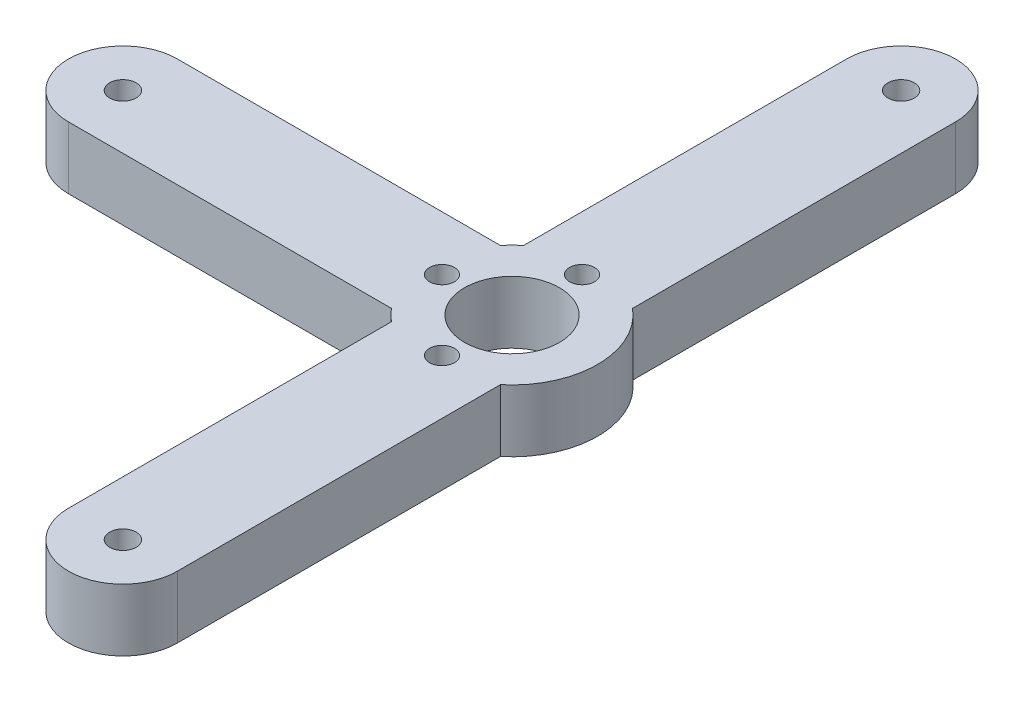
from build123d import *

# Parameters (mm, degrees)
BASE_OUTLINE_SKETCH_R          = 6.1
BASE_OUTLINE_SKETCH_R_2        = 3.1
BASE_OUTLINE_DEPTH             = 1
INTERFACE_PROFILE_2_SKETCH_R   = 6.1
INTERFACE_PROFILE_2_SKETCH_R_2 = 3.1
INTERFACE_PROFILE_2_SKETCH_R_3 = 1.1
INTERFACE_PROFILE_2_DEPTH      = 0.6
INTERFACE_PROFILE_3_SKETCH_R   = 1.7
INTERFACE_PROFILE_3_SKETCH_R_2 = 6.1
INTERFACE_PROFILE_3_SKETCH_R_3 = 1.1
INTERFACE_PROFILE_3_DEPTH      = 2.4
INTERFACE_PROFILE_4_SKETCH_R   = 1.7
INTERFACE_PROFILE_4_SKETCH_R_2 = 6.1
INTERFACE_PROFILE_4_SKETCH_R_3 = 1.6
INTERFACE_PROFILE_4_DEPTH      = 4


with BuildPart() as part:
    # Base Outline Sketch → Base Outline (new body)
    with BuildSketch(Plane(origin=(0, 149, 0), x_dir=(1, 0, 0), z_dir=(0, 1, 0))):
        with BuildLine():
            Line((-64.77693262, -7), (-106.291651246, -7))
            ThreePointArc((-106.291651246, -7), (-113.291651246, 0), (-106.291651246, 7))
            Line((-106.291651246, 7), (-64.77693262, 7))
            ThreePointArc((-64.77693262, 7), (-64.069825839, 7.778174593), (-63.291651246, 8.485281374))
            Line((-63.291651246, 8.485281374), (-63.291651246, 50))
            ThreePointArc((-63.291651246, 50), (-56.291651246, 57), (-49.291651246, 50))
            Line((-49.291651246, 50), (-49.291651246, 8.485281374))
            ThreePointArc((-49.291651246, 8.485281374), (-45.291651246, 0), (-49.291651246, -8.485281374))
            Line((-49.291651246, -8.485281374), (-49.291651246, -50))
            ThreePointArc((-49.291651246, -50), (-56.291651246, -57), (-63.291651246, -50))
            Line((-63.291651246, -50), (-63.291651246, -8.485281374))
            ThreePointArc((-63.291651246, -8.485281374), (-64.069825839, -7.778174593), (-64.77693262, -7))
        make_face()
        with Locations(Location((-56.291651246, 0, 0), (0, 0, 270))):
            Circle(BASE_OUTLINE_SKETCH_R, mode=Mode.SUBTRACT)
        with Locations(Location((-106.291651246, 0, 0), (0, 0, 270))):
            Circle(BASE_OUTLINE_SKETCH_R_2, mode=Mode.SUBTRACT)
        with Locations(Location((-56.291651246, 50, 0), (0, 0, 270))):
            Circle(BASE_OUTLINE_SKETCH_R_2, mode=Mode.SUBTRACT)
        with Locations(Location((-56.291651246, -50, 0), (0, 0, 270))):
            Circle(BASE_OUTLINE_SKETCH_R_2, mode=Mode.SUBTRACT)
    extrude(amount=BASE_OUTLINE_DEPTH)

    # Interface Profile 2 Sketch → Interface Profile 2 (add)
    with BuildSketch(Plane(origin=(0, 150, 0), x_dir=(1, 0, 0), z_dir=(0, 1, 0))):
        with BuildLine():
            Line((-64.77693262, -7), (-106.291651246, -7))
            ThreePointArc((-106.291651246, -7), (-113.291651246, 0), (-106.291651246, 7))
            Line((-106.291651246, 7), (-64.77693262, 7))
            ThreePointArc((-64.77693262, 7), (-64.069825839, 7.778174593), (-63.291651246, 8.485281374))
            Line((-63.291651246, 8.485281374), (-63.291651246, 50))
            ThreePointArc((-63.291651246, 50), (-56.291651246, 57), (-49.291651246, 50))
            Line((-49.291651246, 50), (-49.291651246, 8.485281374))
            ThreePointArc((-49.291651246, 8.485281374), (-45.291651246, 0), (-49.291651246, -8.485281374))
            Line((-49.291651246, -8.485281374), (-49.291651246, -50))
            ThreePointArc((-49.291651246, -50), (-56.291651246, -57), (-63.291651246, -50))
            Line((-63.291651246, -50), (-63.291651246, -8.485281374))
            ThreePointArc((-63.291651246, -8.485281374), (-64.069825839, -7.778174593), (-64.77693262, -7))
        make_face()
        with Locations(Location((-56.291651246, 0, 0), (0, 0, 270))):
            Circle(INTERFACE_PROFILE_2_SKETCH_R, mode=Mode.SUBTRACT)
        with Locations(Location((-106.291651246, 0, 0), (0, 0, 270))):
            Circle(INTERFACE_PROFILE_2_SKETCH_R_2, mode=Mode.SUBTRACT)
        with Locations(Location((-56.291651246, 50, 0), (0, 0, 270))):
            Circle(INTERFACE_PROFILE_2_SKETCH_R_2, mode=Mode.SUBTRACT)
        with Locations(Location((-56.291651246, -50, 0), (0, 0, 270))):
            Circle(INTERFACE_PROFILE_2_SKETCH_R_2, mode=Mode.SUBTRACT)
        with Locations(Location((-65.291651246, 0, 0), (0, 0, 270))):
            Circle(INTERFACE_PROFILE_2_SKETCH_R_3, mode=Mode.SUBTRACT)
        with Locations(Location((-56.291651246, -9, 0), (0, 0, 270))):
            Circle(INTERFACE_PROFILE_2_SKETCH_R_3, mode=Mode.SUBTRACT)
        with Locations(Location((-56.291651246, 9, 0), (0, 0, 270))):
            Circle(INTERFACE_PROFILE_2_SKETCH_R_3, mode=Mode.SUBTRACT)
    extrude(amount=INTERFACE_PROFILE_2_DEPTH)

    # Interface Profile 3 Sketch → Interface Profile 3 (add)
    with BuildSketch(Plane(origin=(0, 150.6, 0), x_dir=(1, 0, 0), z_dir=(0, 1, 0))):
        with BuildLine():
            Line((-64.77693262, -7), (-106.291651246, -7))
            ThreePointArc((-106.291651246, -7), (-113.291651246, 0), (-106.291651246, 7))
            Line((-106.291651246, 7), (-64.77693262, 7))
            ThreePointArc((-64.77693262, 7), (-64.069825839, 7.778174593), (-63.291651246, 8.485281374))
            Line((-63.291651246, 8.485281374), (-63.291651246, 50))
            ThreePointArc((-63.291651246, 50), (-56.291651246, 57), (-49.291651246, 50))
            Line((-49.291651246, 50), (-49.291651246, 8.485281374))
            ThreePointArc((-49.291651246, 8.485281374), (-45.291651246, 0), (-49.291651246, -8.485281374))
            Line((-49.291651246, -8.485281374), (-49.291651246, -50))
            ThreePointArc((-49.291651246, -50), (-56.291651246, -57), (-63.291651246, -50))
            Line((-63.291651246, -50), (-63.291651246, -8.485281374))
            ThreePointArc((-63.291651246, -8.485281374), (-64.069825839, -7.778174593), (-64.77693262, -7))
        make_face()
        with Locations(Location((-106.291651246, 0, 0), (0, 0, 270))):
            Circle(INTERFACE_PROFILE_3_SKETCH_R, mode=Mode.SUBTRACT)
        with Locations(Location((-56.291651246, 50, 0), (0, 0, 270))):
            Circle(INTERFACE_PROFILE_3_SKETCH_R, mode=Mode.SUBTRACT)
        with Locations(Location((-56.291651246, 0, 0), (0, 0, 270))):
            Circle(INTERFACE_PROFILE_3_SKETCH_R_2, mode=Mode.SUBTRACT)
        with Locations(Location((-56.291651246, -50, 0), (0, 0, 270))):
            Circle(INTERFACE_PROFILE_3_SKETCH_R, mode=Mode.SUBTRACT)
        with Locations(Location((-65.291651246, 0, 0), (0, 0, 270))):
            Circle(INTERFACE_PROFILE_3_SKETCH_R_3, mode=Mode.SUBTRACT)
        with Locations(Location((-56.291651246, -9, 0), (0, 0, 270))):
            Circle(INTERFACE_PROFILE_3_SKETCH_R_3, mode=Mode.SUBTRACT)
        with Locations(Location((-56.291651246, 9, 0), (0, 0, 270))):
            Circle(INTERFACE_PROFILE_3_SKETCH_R_3, mode=Mode.SUBTRACT)
    extrude(amount=INTERFACE_PROFILE_3_DEPTH)

    # Interface Profile 4 Sketch → Interface Profile 4 (add)
    with BuildSketch(Plane(origin=(0, 153, 0), x_dir=(1, 0, 0), z_dir=(0, 1, 0))):
        with BuildLine():
            Line((-64.77693262, -7), (-106.291651246, -7))
            ThreePointArc((-106.291651246, -7), (-113.291651246, 0), (-106.291651246, 7))
            Line((-106.291651246, 7), (-64.77693262, 7))
            ThreePointArc((-64.77693262, 7), (-64.069825839, 7.778174593), (-63.291651246, 8.485281374))
            Line((-63.291651246, 8.485281374), (-63.291651246, 50))
            ThreePointArc((-63.291651246, 50), (-56.291651246, 57), (-49.291651246, 50))
            Line((-49.291651246, 50), (-49.291651246, 8.485281374))
            ThreePointArc((-49.291651246, 8.485281374), (-45.291651246, 0), (-49.291651246, -8.485281374))
            Line((-49.291651246, -8.485281374), (-49.291651246, -50))
            ThreePointArc((-49.291651246, -50), (-56.291651246, -57), (-63.291651246, -50))
            Line((-63.291651246, -50), (-63.291651246, -8.485281374))
            ThreePointArc((-63.291651246, -8.485281374), (-64.069825839, -7.778174593), (-64.77693262, -7))
        make_face()
        with Locations(Location((-106.291651246, 0, 0), (0, 0, 270))):
            Circle(INTERFACE_PROFILE_4_SKETCH_R, mode=Mode.SUBTRACT)
        with Locations(Location((-56.291651246, 50, 0), (0, 0, 270))):
            Circle(INTERFACE_PROFILE_4_SKETCH_R, mode=Mode.SUBTRACT)
        with Locations(Location((-56.291651246, 0, 0), (0, 0, 270))):
            Circle(INTERFACE_PROFILE_4_SKETCH_R_2, mode=Mode.SUBTRACT)
        with Locations(Location((-56.291651246, -50, 0), (0, 0, 270))):
            Circle(INTERFACE_PROFILE_4_SKETCH_R, mode=Mode.SUBTRACT)
        with Locations(Location((-65.291651246, 0, 0), (0, 0, 270))):
            Circle(INTERFACE_PROFILE_4_SKETCH_R_3, mode=Mode.SUBTRACT)
        with Locations(Location((-56.291651246, -9, 0), (0, 0, 270))):
            Circle(INTERFACE_PROFILE_4_SKETCH_R_3, mode=Mode.SUBTRACT)
        with Locations(Location((-56.291651246, 9, 0), (0, 0, 270))):
            Circle(INTERFACE_PROFILE_4_SKETCH_R_3, mode=Mode.SUBTRACT)
    extrude(amount=INTERFACE_PROFILE_4_DEPTH)


solid = part.part
